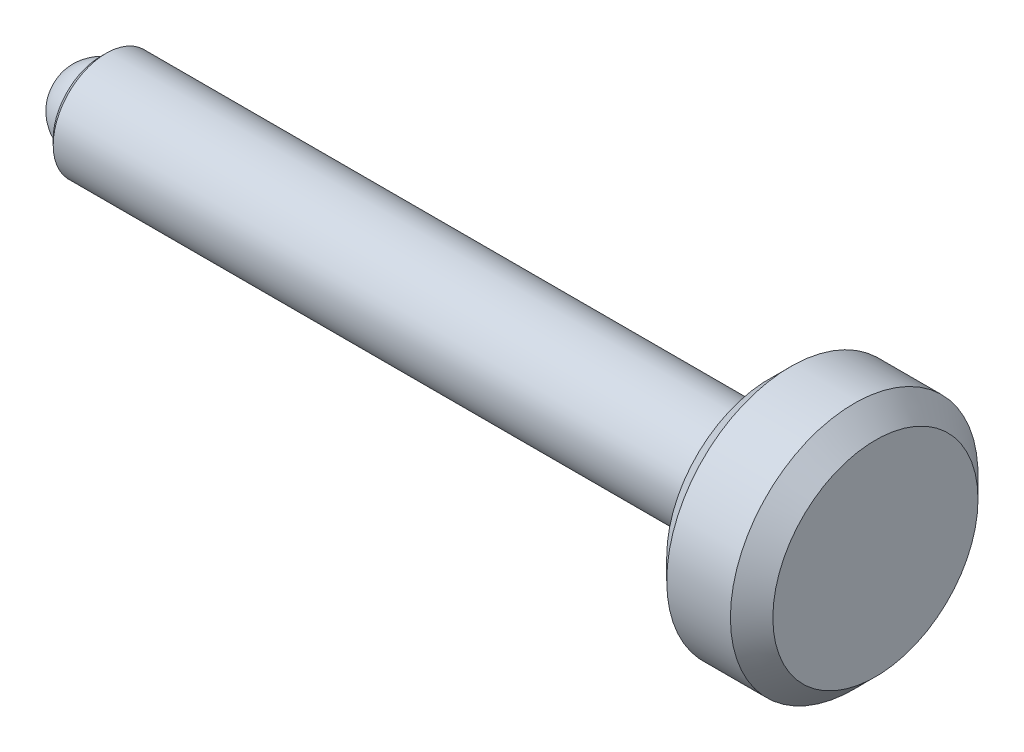
from build123d import *


with BuildPart() as part:
    # 草图1 → 旋转1 (revolve)
    with BuildSketch(Plane.XY):
        with BuildLine():
            Line((1.1, 1.1), (1.1, 1.3465))
            Line((1.1, 1.3465), (1.2535, 1.5))
            Line((1.2535, 1.5), (19.1, 1.5))
            Line((19.1, 1.5), (19.1, 1.3465))
            Line((19.1, 1.3465), (20, 1.3465))
            Line((20, 1.3465), (20, 2.9))
            Line((20, 2.9), (20.6, 3.5))
            Line((20.6, 3.5), (22.4, 3.5))
            Line((22.4, 3.5), (23, 2.9))
            Line((23, 2.9), (23, 0))
            Line((23, 0), (0, 0))
            ThreePointArc((0, 0), (0.322182541, 0.777817459), (1.1, 1.1))
        make_face()
    revolve(axis=Axis((23, 0, 0), (-1, 0, 0)))


solid = part.part
